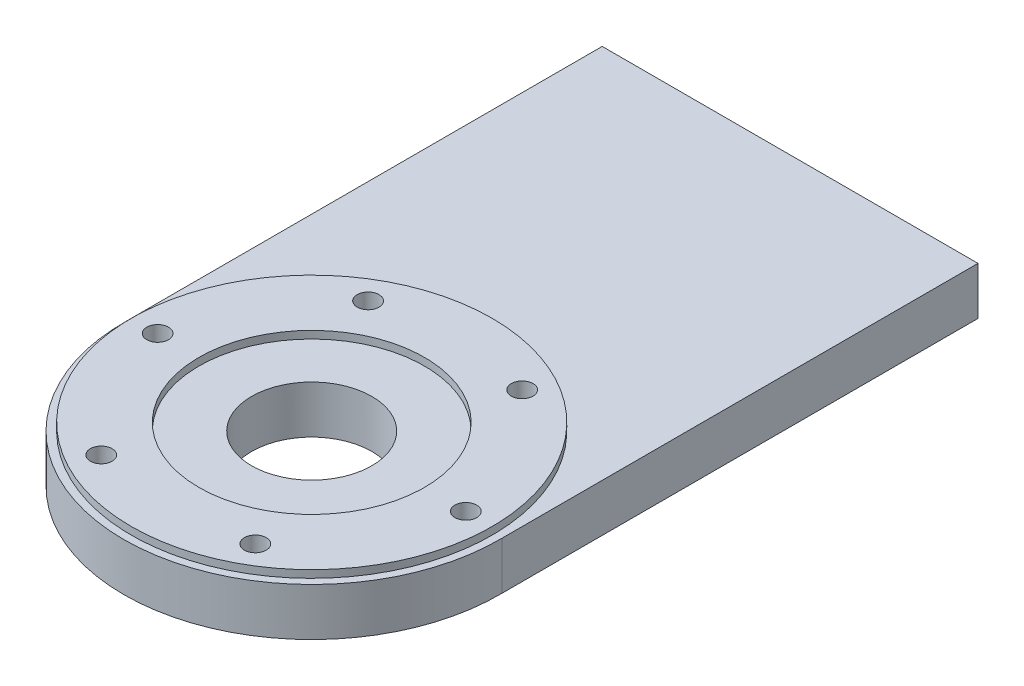
from build123d import *

# Parameters (mm, degrees)
PARED_START                    = -27.85
SK_PARED_W                     = 50
SK_PARED_H                     = 63.3
PARED_DEPTH                    = 6.35
CABEZA_START                   = -27.85
SK_CABEZA_R                    = 25
CABEZA_DEPTH                   = 6.35
ASIENTO_1MM_START              = -21.5
SK_ASIENTO_1MM_R               = 24
SK_ASIENTO_1MM_R_2             = 15
ASIENTO_1MM_DEPTH              = 1
PASO_CENTRAL_START             = -27.85
SK_PASO_CENTRAL_R              = 8
PASO_CENTRAL_DEPTH             = 7.35
PASANTES_M2_5_ESTATOR_J5_START = -27.85
SK_PASANTES_M2_5_ESTATOR_J5_R  = 1.45
PASANTES_M2_5_ESTATOR_J5_DEPTH = 7.35
CAJAS_M2_5_J5_START            = -27.85
SK_CAJAS_M2_5_J5_R             = 2.75
CAJAS_M2_5_J5_DEPTH            = 2.5
SK_ROSCA_M3_DESDE_ABAJO_R      = 1.25
ROSCA_M3_DESDE_ABAJO_DEPTH     = 9


with BuildPart() as part:
    # Sk_Pared → Pared (new body)
    with BuildSketch(Plane(origin=(0, 0, 0), x_dir=(1, 0, 0), z_dir=(0, 1, 0)).offset(PARED_START)):
        with Locations((0, -458)):
            Rectangle(SK_PARED_W, SK_PARED_H)
    extrude(amount=PARED_DEPTH)

    # Sk_Cabeza → Cabeza (add)
    with BuildSketch(Plane(origin=(0, 0, 0), x_dir=(1, 0, 0), z_dir=(0, 1, 0)).offset(CABEZA_START)):
        with Locations((0, -490)):
            Circle(SK_CABEZA_R)
    extrude(amount=CABEZA_DEPTH)

    # Sk_Asiento_1mm → Asiento_1mm (add)
    with BuildSketch(Plane(origin=(0, 0, 0), x_dir=(1, 0, 0), z_dir=(0, 1, 0)).offset(ASIENTO_1MM_START)):
        with Locations(Location((0, -490, 0), (0, 0, 90))):
            Circle(SK_ASIENTO_1MM_R)
        with Locations(Location((0, -490, 0), (0, 0, 270))):
            Circle(SK_ASIENTO_1MM_R_2, mode=Mode.SUBTRACT)
    extrude(amount=ASIENTO_1MM_DEPTH)

    # Sk_Paso_central → Paso_central (cut)
    with BuildSketch(Plane(origin=(0, 0, 0), x_dir=(1, 0, 0), z_dir=(0, 1, 0)).offset(PASO_CENTRAL_START)):
        with Locations(Location((0, -490, 0), (0, 0, 90))):
            Circle(SK_PASO_CENTRAL_R)
    extrude(amount=PASO_CENTRAL_DEPTH, mode=Mode.SUBTRACT)

    # Sk_Pasantes_M2-5_estator_J5 → Pasantes_M2-5_estator_J5 (cut)
    with BuildSketch(Plane(origin=(0, 0, 0), x_dir=(1, 0, 0), z_dir=(0, 1, 0)).offset(PASANTES_M2_5_ESTATOR_J5_START)):
        with Locations(Location((20.5, -490, 0), (0, 0, 270))):
            Circle(SK_PASANTES_M2_5_ESTATOR_J5_R)
        with Locations(Location((10.25, -507.753520778, 0), (0, 0, 270))):
            Circle(SK_PASANTES_M2_5_ESTATOR_J5_R)
        with Locations(Location((-10.25, -507.753520778, 0), (0, 0, 270))):
            Circle(SK_PASANTES_M2_5_ESTATOR_J5_R)
        with Locations(Location((-20.5, -490, 0), (0, 0, 270))):
            Circle(SK_PASANTES_M2_5_ESTATOR_J5_R)
        with Locations(Location((-10.25, -472.246479222, 0), (0, 0, 270))):
            Circle(SK_PASANTES_M2_5_ESTATOR_J5_R)
        with Locations(Location((10.25, -472.246479222, 0), (0, 0, 270))):
            Circle(SK_PASANTES_M2_5_ESTATOR_J5_R)
    extrude(amount=PASANTES_M2_5_ESTATOR_J5_DEPTH, mode=Mode.SUBTRACT)

    # Sk_Cajas_M2-5_J5 → Cajas_M2-5_J5 (cut)
    with BuildSketch(Plane(origin=(0, 0, 0), x_dir=(1, 0, 0), z_dir=(0, 1, 0)).offset(CAJAS_M2_5_J5_START)):
        with Locations(Location((10.25, -507.753520778, 0), (0, 0, 270))):
            Circle(SK_CAJAS_M2_5_J5_R)
        with Locations(Location((-10.25, -507.753520778, 0), (0, 0, 270))):
            Circle(SK_CAJAS_M2_5_J5_R)
        with Locations(Location((-10.25, -472.246479222, 0), (0, 0, 270))):
            Circle(SK_CAJAS_M2_5_J5_R)
        with Locations(Location((10.25, -472.246479222, 0), (0, 0, 270))):
            Circle(SK_CAJAS_M2_5_J5_R)
    extrude(amount=CAJAS_M2_5_J5_DEPTH, mode=Mode.SUBTRACT)

    # Sk_Rosca_M3_desde_abajo → Rosca_M3_desde_abajo (cut)
    with BuildSketch(Plane(origin=(0, 0, 426.35), x_dir=(-1, 0, 0), z_dir=(0, 0, -1))):
        with Locations((15, -24.675)):
            Circle(SK_ROSCA_M3_DESDE_ABAJO_R)
        with Locations((-15, -24.675)):
            Circle(SK_ROSCA_M3_DESDE_ABAJO_R)
    extrude(amount=-ROSCA_M3_DESDE_ABAJO_DEPTH, mode=Mode.SUBTRACT)


solid = part.part
